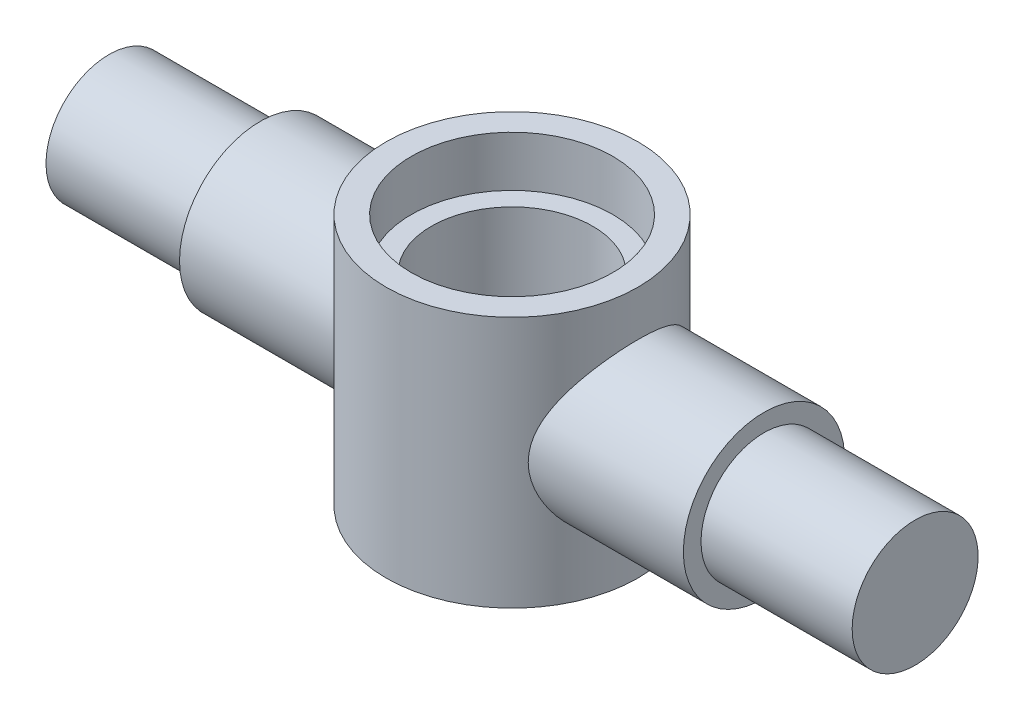
from build123d import *

# Parameters (mm, degrees)
SKETCH1_R                                = 25
BOSS_EXTRUDE1_DEPTH                      = 25
CBORE_FOR_M16_HEX_HEAD_BOLT1_D           = 32
CBORE_FOR_M16_HEX_HEAD_BOLT1_DEPTH       = 50
CBORE_FOR_M16_HEX_HEAD_BOLT1_CBORE_D     = 40
CBORE_FOR_M16_HEX_HEAD_BOLT1_CBORE_DEPTH = 10
CBORE_FOR_M16_HEX_HEAD_BOLT1_TIP         = 9.613769904


with BuildPart() as part:
    # Sketch1 → Boss-Extrude1 (new, symmetric)
    with BuildSketch(Plane(origin=(0, 0, 0), x_dir=(1, 0, 0), z_dir=(0, 1, 0))):
        with Locations(Location((0, 0, 0), (0, 0, 270))):
            Circle(SKETCH1_R)
    extrude(amount=BOSS_EXTRUDE1_DEPTH, both=True)

    # Sketch2 → Revolve1 (revolve)
    with BuildSketch(Plane.XY, mode=Mode.PRIVATE) as revolve1_sk:
        Polygon((-50, 16), (50, 16), (50, 12.5), (80, 12.5), (80, 0), (-80, 0), (-80, 12.5), (-50, 12.5), align=None)
    revolve(revolve1_sk.sketch.rotate(Axis((-80, 0, 0), (1, 0, 0)), 90), axis=Axis((-80, 0, 0), (1, 0, 0)))

    # CBORE for M16 Hex Head Bolt1
    with Locations(Plane(origin=(0, 25, 0), x_dir=(1, 0, 0), z_dir=(0, 1, 0))):
        with Locations((0, 0)):
            CounterBoreHole(CBORE_FOR_M16_HEX_HEAD_BOLT1_D / 2, CBORE_FOR_M16_HEX_HEAD_BOLT1_CBORE_D / 2, CBORE_FOR_M16_HEX_HEAD_BOLT1_CBORE_DEPTH, depth=CBORE_FOR_M16_HEX_HEAD_BOLT1_DEPTH)
            with Locations((0, 0, -(CBORE_FOR_M16_HEX_HEAD_BOLT1_DEPTH + CBORE_FOR_M16_HEX_HEAD_BOLT1_TIP / 2))):  # 118° drill point
                Cone(0, CBORE_FOR_M16_HEX_HEAD_BOLT1_D / 2, CBORE_FOR_M16_HEX_HEAD_BOLT1_TIP, mode=Mode.SUBTRACT)


solid = part.part
